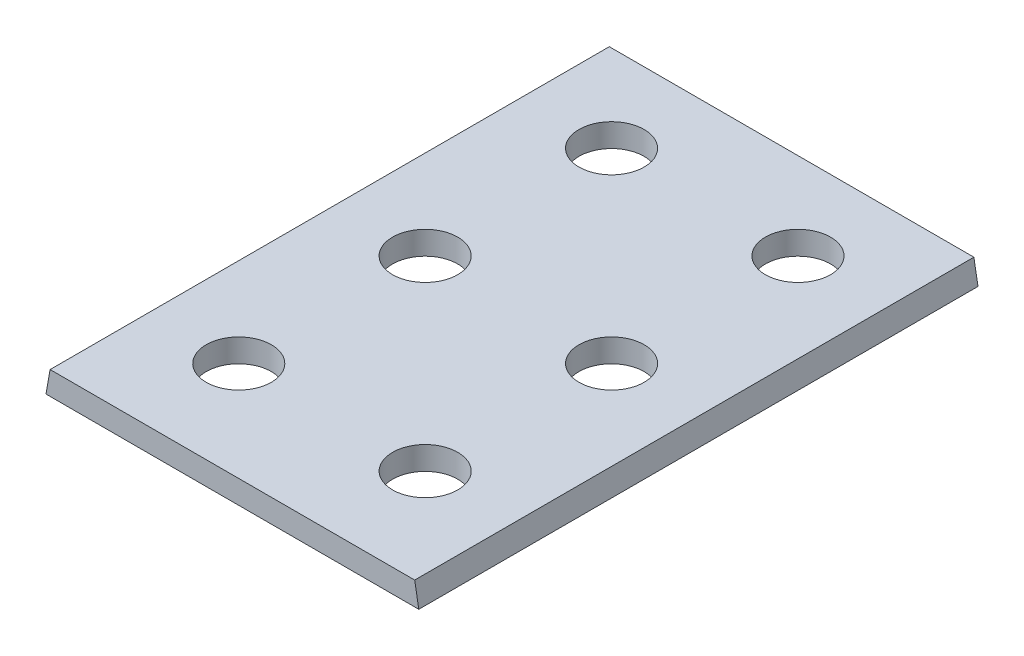
from build123d import *

# Parameters (mm, degrees)
SKETCH1_W                = 108
SKETCH1_H                = 162
SKETCH1_R                = 9.438144972
BOSS_EXTRUDE1_DEPTH      = 6.75
CUT_EXTRUDE16_DEPTH      = 500
CUT_EXTRUDE16_DEPTH_BACK = 6.75


with BuildPart() as part:
    # Sketch1 → Boss-Extrude1 (new body)
    with BuildSketch(Plane(origin=(0, 0, 0), x_dir=(1, 0, 0), z_dir=(0, 1, 0))):
        with Locations((54, -81)):
            Rectangle(SKETCH1_W, SKETCH1_H)
        with Locations(Location((27, -133.156149589, 0), (0, 0, 270))):
            Circle(SKETCH1_R, mode=Mode.SUBTRACT)
        with Locations(Location((81, -133.156149589, 0), (0, 0, 270))):
            Circle(SKETCH1_R, mode=Mode.SUBTRACT)
        with Locations(Location((81, -79.156149589, 0), (0, 0, 270))):
            Circle(SKETCH1_R, mode=Mode.SUBTRACT)
        with Locations(Location((81, -25.156149589, 0), (0, 0, 270))):
            Circle(SKETCH1_R, mode=Mode.SUBTRACT)
        with Locations(Location((27, -79.156149589, 0), (0, 0, 270))):
            Circle(SKETCH1_R, mode=Mode.SUBTRACT)
        with Locations(Location((27, -25.156149589, 0), (0, 0, 270))):
            Circle(SKETCH1_R, mode=Mode.SUBTRACT)
    extrude(amount=BOSS_EXTRUDE1_DEPTH)

    # Sketch2 → Cut-Extrude16 (cut, two sides: drawn at the far end of the back side and taken through both)
    with BuildSketch(Plane.XY.offset(-CUT_EXTRUDE16_DEPTH_BACK)):
        Polygon((0, 6.75), (0, 0), (1.19020712, 6.75), align=None)
        Polygon((108, 6.75), (108, 0), (106.80979288, 6.75), align=None)
    extrude(amount=CUT_EXTRUDE16_DEPTH + CUT_EXTRUDE16_DEPTH_BACK, mode=Mode.SUBTRACT)


solid = part.part
